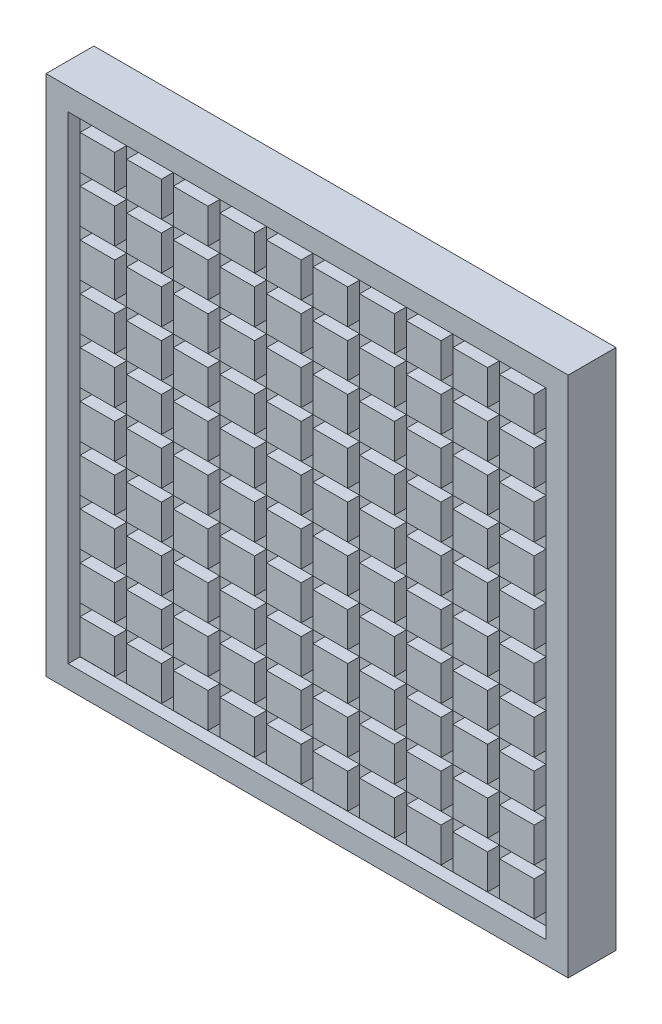
from build123d import *

# Parameters (mm, degrees)
SKETCH_1_W          = 437
SKETCH_1_H          = 437
EXTRUDE_1_DEPTH     = 40
SKETCH_3_W          = 400
SKETCH_3_H          = 400
CUT_EXTRUDE_1_DEPTH = 10
SKETCH_4_W          = 29
SKETCH_4_H          = 29
EXTRUDE_2_DEPTH     = 10
SCALE_1_SCALE       = 0.94089


with BuildPart() as part:
    # 草图1 → 凸台-拉伸1 (new body)
    with BuildSketch(Plane.XY):
        with Locations((218.5, 218.5)):
            Rectangle(SKETCH_1_W, SKETCH_1_H)
    extrude(amount=EXTRUDE_1_DEPTH)

    # 草图3 → 切除-拉伸1 (cut)
    with BuildSketch(Plane.XY.offset(40)):
        with Locations((218.5, 218.5)):
            Rectangle(SKETCH_3_W, SKETCH_3_H)
    extrude(amount=-CUT_EXTRUDE_1_DEPTH, mode=Mode.SUBTRACT)

    # 草图4 → 凸台-拉伸2 (add)
    with BuildSketch(Plane.XY.offset(30)):
        with Locations((82, 394.128297888)):
            Rectangle(SKETCH_4_W, SKETCH_4_H)
        with Locations((43, 394.128297888)):
            Rectangle(SKETCH_4_W, SKETCH_4_H)
        with Locations((121, 394.128297888)):
            Rectangle(SKETCH_4_W, SKETCH_4_H)
        with Locations((160, 394.128297888)):
            Rectangle(SKETCH_4_W, SKETCH_4_H)
        with Locations((199, 394.128297888)):
            Rectangle(SKETCH_4_W, SKETCH_4_H)
        with Locations((238, 394.128297888)):
            Rectangle(SKETCH_4_W, SKETCH_4_H)
        with Locations((277, 394.128297888)):
            Rectangle(SKETCH_4_W, SKETCH_4_H)
        with Locations((316, 394.128297888)):
            Rectangle(SKETCH_4_W, SKETCH_4_H)
        with Locations((355, 394.128297888)):
            Rectangle(SKETCH_4_W, SKETCH_4_H)
        with Locations((394, 394.128297888)):
            Rectangle(SKETCH_4_W, SKETCH_4_H)
        with Locations((82, 355.128297888)):
            Rectangle(SKETCH_4_W, SKETCH_4_H)
        with Locations((121, 355.128297888)):
            Rectangle(SKETCH_4_W, SKETCH_4_H)
        with Locations((160, 355.128297888)):
            Rectangle(SKETCH_4_W, SKETCH_4_H)
        with Locations((199, 355.128297888)):
            Rectangle(SKETCH_4_W, SKETCH_4_H)
        with Locations((238, 355.128297888)):
            Rectangle(SKETCH_4_W, SKETCH_4_H)
        with Locations((277, 355.128297888)):
            Rectangle(SKETCH_4_W, SKETCH_4_H)
        with Locations((316, 355.128297888)):
            Rectangle(SKETCH_4_W, SKETCH_4_H)
        with Locations((355, 355.128297888)):
            Rectangle(SKETCH_4_W, SKETCH_4_H)
        with Locations((394, 355.128297888)):
            Rectangle(SKETCH_4_W, SKETCH_4_H)
        with Locations((82, 316.128297888)):
            Rectangle(SKETCH_4_W, SKETCH_4_H)
        with Locations((121, 316.128297888)):
            Rectangle(SKETCH_4_W, SKETCH_4_H)
        with Locations((160, 316.128297888)):
            Rectangle(SKETCH_4_W, SKETCH_4_H)
        with Locations((199, 316.128297888)):
            Rectangle(SKETCH_4_W, SKETCH_4_H)
        with Locations((238, 316.128297888)):
            Rectangle(SKETCH_4_W, SKETCH_4_H)
        with Locations((277, 316.128297888)):
            Rectangle(SKETCH_4_W, SKETCH_4_H)
        with Locations((316, 316.128297888)):
            Rectangle(SKETCH_4_W, SKETCH_4_H)
        with Locations((355, 316.128297888)):
            Rectangle(SKETCH_4_W, SKETCH_4_H)
        with Locations((394, 316.128297888)):
            Rectangle(SKETCH_4_W, SKETCH_4_H)
        with Locations((82, 277.128297888)):
            Rectangle(SKETCH_4_W, SKETCH_4_H)
        with Locations((121, 277.128297888)):
            Rectangle(SKETCH_4_W, SKETCH_4_H)
        with Locations((160, 277.128297888)):
            Rectangle(SKETCH_4_W, SKETCH_4_H)
        with Locations((199, 277.128297888)):
            Rectangle(SKETCH_4_W, SKETCH_4_H)
        with Locations((238, 277.128297888)):
            Rectangle(SKETCH_4_W, SKETCH_4_H)
        with Locations((277, 277.128297888)):
            Rectangle(SKETCH_4_W, SKETCH_4_H)
        with Locations((316, 277.128297888)):
            Rectangle(SKETCH_4_W, SKETCH_4_H)
        with Locations((355, 277.128297888)):
            Rectangle(SKETCH_4_W, SKETCH_4_H)
        with Locations((394, 277.128297888)):
            Rectangle(SKETCH_4_W, SKETCH_4_H)
        with Locations((82, 238.128297888)):
            Rectangle(SKETCH_4_W, SKETCH_4_H)
        with Locations((121, 238.128297888)):
            Rectangle(SKETCH_4_W, SKETCH_4_H)
        with Locations((160, 238.128297888)):
            Rectangle(SKETCH_4_W, SKETCH_4_H)
        with Locations((199, 238.128297888)):
            Rectangle(SKETCH_4_W, SKETCH_4_H)
        with Locations((238, 238.128297888)):
            Rectangle(SKETCH_4_W, SKETCH_4_H)
        with Locations((277, 238.128297888)):
            Rectangle(SKETCH_4_W, SKETCH_4_H)
        with Locations((316, 238.128297888)):
            Rectangle(SKETCH_4_W, SKETCH_4_H)
        with Locations((355, 238.128297888)):
            Rectangle(SKETCH_4_W, SKETCH_4_H)
        with Locations((394, 238.128297888)):
            Rectangle(SKETCH_4_W, SKETCH_4_H)
        with Locations((82, 199.128297888)):
            Rectangle(SKETCH_4_W, SKETCH_4_H)
        with Locations((121, 199.128297888)):
            Rectangle(SKETCH_4_W, SKETCH_4_H)
        with Locations((160, 199.128297888)):
            Rectangle(SKETCH_4_W, SKETCH_4_H)
        with Locations((199, 199.128297888)):
            Rectangle(SKETCH_4_W, SKETCH_4_H)
        with Locations((238, 199.128297888)):
            Rectangle(SKETCH_4_W, SKETCH_4_H)
        with Locations((277, 199.128297888)):
            Rectangle(SKETCH_4_W, SKETCH_4_H)
        with Locations((316, 199.128297888)):
            Rectangle(SKETCH_4_W, SKETCH_4_H)
        with Locations((355, 199.128297888)):
            Rectangle(SKETCH_4_W, SKETCH_4_H)
        with Locations((394, 199.128297888)):
            Rectangle(SKETCH_4_W, SKETCH_4_H)
        with Locations((82, 160.128297888)):
            Rectangle(SKETCH_4_W, SKETCH_4_H)
        with Locations((121, 160.128297888)):
            Rectangle(SKETCH_4_W, SKETCH_4_H)
        with Locations((160, 160.128297888)):
            Rectangle(SKETCH_4_W, SKETCH_4_H)
        with Locations((199, 160.128297888)):
            Rectangle(SKETCH_4_W, SKETCH_4_H)
        with Locations((238, 160.128297888)):
            Rectangle(SKETCH_4_W, SKETCH_4_H)
        with Locations((277, 160.128297888)):
            Rectangle(SKETCH_4_W, SKETCH_4_H)
        with Locations((316, 160.128297888)):
            Rectangle(SKETCH_4_W, SKETCH_4_H)
        with Locations((355, 160.128297888)):
            Rectangle(SKETCH_4_W, SKETCH_4_H)
        with Locations((394, 160.128297888)):
            Rectangle(SKETCH_4_W, SKETCH_4_H)
        with Locations((82, 121.128297888)):
            Rectangle(SKETCH_4_W, SKETCH_4_H)
        with Locations((121, 121.128297888)):
            Rectangle(SKETCH_4_W, SKETCH_4_H)
        with Locations((160, 121.128297888)):
            Rectangle(SKETCH_4_W, SKETCH_4_H)
        with Locations((199, 121.128297888)):
            Rectangle(SKETCH_4_W, SKETCH_4_H)
        with Locations((238, 121.128297888)):
            Rectangle(SKETCH_4_W, SKETCH_4_H)
        with Locations((277, 121.128297888)):
            Rectangle(SKETCH_4_W, SKETCH_4_H)
        with Locations((316, 121.128297888)):
            Rectangle(SKETCH_4_W, SKETCH_4_H)
        with Locations((355, 121.128297888)):
            Rectangle(SKETCH_4_W, SKETCH_4_H)
        with Locations((394, 121.128297888)):
            Rectangle(SKETCH_4_W, SKETCH_4_H)
        with Locations((82, 82.128297888)):
            Rectangle(SKETCH_4_W, SKETCH_4_H)
        with Locations((121, 82.128297888)):
            Rectangle(SKETCH_4_W, SKETCH_4_H)
        with Locations((160, 82.128297888)):
            Rectangle(SKETCH_4_W, SKETCH_4_H)
        with Locations((199, 82.128297888)):
            Rectangle(SKETCH_4_W, SKETCH_4_H)
        with Locations((238, 82.128297888)):
            Rectangle(SKETCH_4_W, SKETCH_4_H)
        with Locations((277, 82.128297888)):
            Rectangle(SKETCH_4_W, SKETCH_4_H)
        with Locations((316, 82.128297888)):
            Rectangle(SKETCH_4_W, SKETCH_4_H)
        with Locations((355, 82.128297888)):
            Rectangle(SKETCH_4_W, SKETCH_4_H)
        with Locations((394, 82.128297888)):
            Rectangle(SKETCH_4_W, SKETCH_4_H)
        with Locations((82, 43.128297888)):
            Rectangle(SKETCH_4_W, SKETCH_4_H)
        with Locations((121, 43.128297888)):
            Rectangle(SKETCH_4_W, SKETCH_4_H)
        with Locations((160, 43.128297888)):
            Rectangle(SKETCH_4_W, SKETCH_4_H)
        with Locations((199, 43.128297888)):
            Rectangle(SKETCH_4_W, SKETCH_4_H)
        with Locations((238, 43.128297888)):
            Rectangle(SKETCH_4_W, SKETCH_4_H)
        with Locations((277, 43.128297888)):
            Rectangle(SKETCH_4_W, SKETCH_4_H)
        with Locations((316, 43.128297888)):
            Rectangle(SKETCH_4_W, SKETCH_4_H)
        with Locations((355, 43.128297888)):
            Rectangle(SKETCH_4_W, SKETCH_4_H)
        with Locations((394, 43.128297888)):
            Rectangle(SKETCH_4_W, SKETCH_4_H)
        with Locations((43, 355.128297888)):
            Rectangle(SKETCH_4_W, SKETCH_4_H)
        with Locations((43, 316.128297888)):
            Rectangle(SKETCH_4_W, SKETCH_4_H)
        with Locations((43, 277.128297888)):
            Rectangle(SKETCH_4_W, SKETCH_4_H)
        with Locations((43, 238.128297888)):
            Rectangle(SKETCH_4_W, SKETCH_4_H)
        with Locations((43, 199.128297888)):
            Rectangle(SKETCH_4_W, SKETCH_4_H)
        with Locations((43, 160.128297888)):
            Rectangle(SKETCH_4_W, SKETCH_4_H)
        with Locations((43, 121.128297888)):
            Rectangle(SKETCH_4_W, SKETCH_4_H)
        with Locations((43, 82.128297888)):
            Rectangle(SKETCH_4_W, SKETCH_4_H)
        with Locations((43, 43.128297888)):
            Rectangle(SKETCH_4_W, SKETCH_4_H)
    extrude(amount=EXTRUDE_2_DEPTH)


with BuildPart() as part_1:
    # 缩放比例1: scaled about (218.5, 218.515683472, 18.345145761)
    add(part.part.scale(SCALE_1_SCALE).moved(Location((12.915535, 12.91646205, 1.084381566))))


solid = part_1.part
